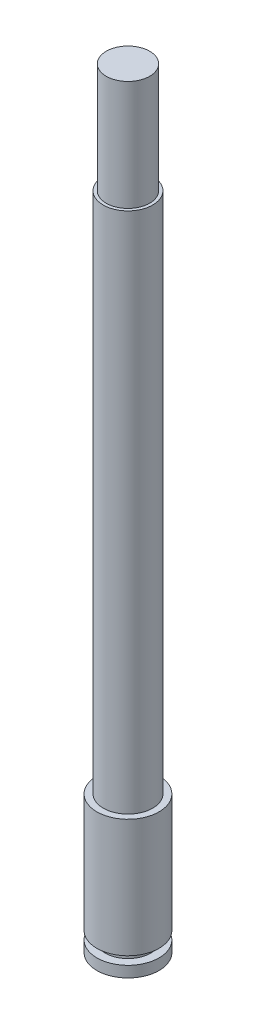
from build123d import *

# Parameters (mm, degrees)
SKETCH1_R           = 5.65
BOSS_EXTRUDE1_DEPTH = 2
SKETCH2_R           = 4.15
BOSS_EXTRUDE2_DEPTH = 1.5
SKETCH3_R           = 5.65
BOSS_EXTRUDE3_DEPTH = 21.5
SKETCH4_R           = 4.5
BOSS_EXTRUDE4_DEPTH = 30
SKETCH5_R           = 4.5
BOSS_EXTRUDE5_DEPTH = 65
SKETCH6_R           = 3.95
BOSS_EXTRUDE6_DEPTH = 20


with BuildPart() as part:
    # Sketch1 → Boss-Extrude1 (new body)
    with BuildSketch(Plane(origin=(0, 0, 0), x_dir=(1, 0, 0), z_dir=(0, 1, 0))):
        with Locations(Location((0, 0, 0), (0, 0, 270))):
            Circle(SKETCH1_R)
    extrude(amount=BOSS_EXTRUDE1_DEPTH)

    # Sketch2 → Boss-Extrude2 (add)
    with BuildSketch(Plane(origin=(0, 2, 0), x_dir=(1, 0, 0), z_dir=(0, 1, 0))):
        with Locations(Location((0, 0, 0), (0, 0, 270))):
            Circle(SKETCH2_R)
    extrude(amount=BOSS_EXTRUDE2_DEPTH)

    # Sketch3 → Boss-Extrude3 (add)
    with BuildSketch(Plane(origin=(0, 3.5, 0), x_dir=(1, 0, 0), z_dir=(0, 1, 0))):
        with Locations(Location((0, 0, 0), (0, 0, 270))):
            Circle(SKETCH3_R)
    extrude(amount=BOSS_EXTRUDE3_DEPTH)

    # Sketch4 → Boss-Extrude4 (add)
    with BuildSketch(Plane(origin=(0, 25, 0), x_dir=(1, 0, 0), z_dir=(0, 1, 0))):
        with Locations(Location((0, 0, 0), (0, 0, 270))):
            Circle(SKETCH4_R)
    extrude(amount=BOSS_EXTRUDE4_DEPTH)

    # Sketch5 → Boss-Extrude5 (add)
    with BuildSketch(Plane(origin=(0, 55, 0), x_dir=(1, 0, 0), z_dir=(0, 1, 0))):
        with Locations(Location((0, 0, 0), (0, 0, 270))):
            Circle(SKETCH5_R)
    extrude(amount=BOSS_EXTRUDE5_DEPTH)

    # Sketch6 → Boss-Extrude6 (add)
    with BuildSketch(Plane(origin=(0, 120, 0), x_dir=(1, 0, 0), z_dir=(0, 1, 0))):
        with Locations(Location((0, 0, 0), (0, 0, 270))):
            Circle(SKETCH6_R)
    extrude(amount=BOSS_EXTRUDE6_DEPTH)


solid = part.part
